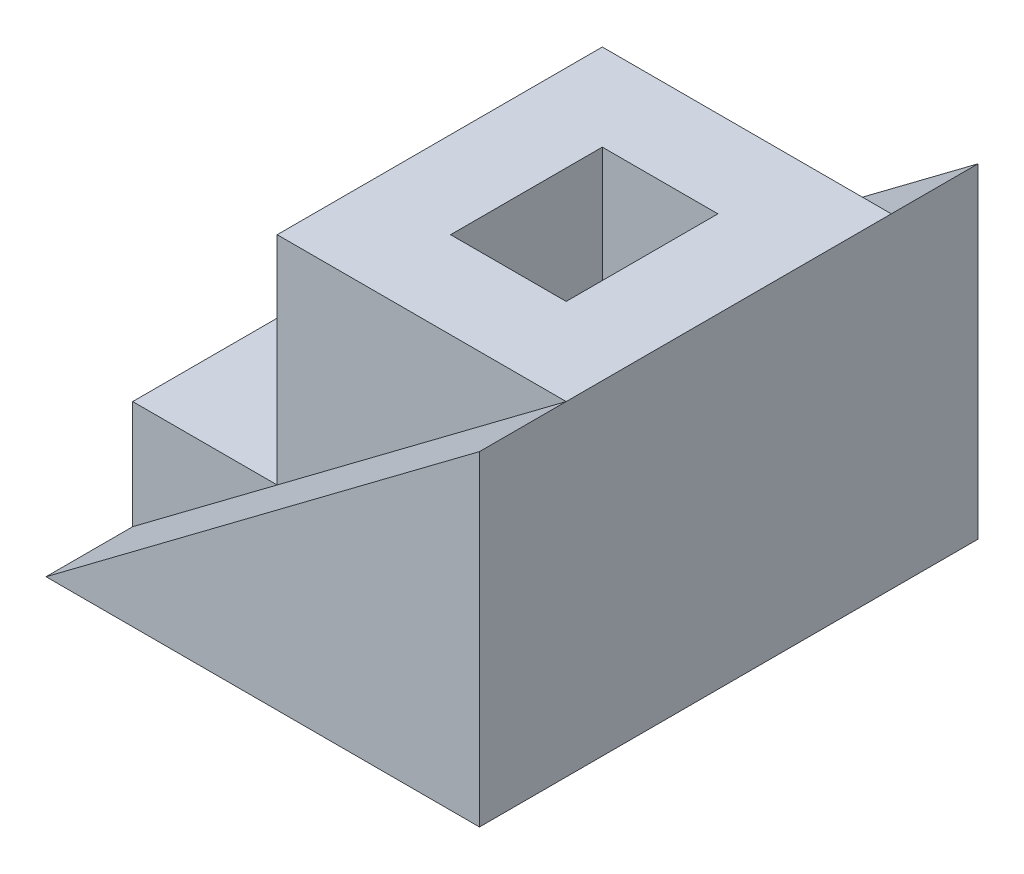
from build123d import *

# Parameters (mm, degrees)
EXTRUDE_1_DEPTH      = 15
EXTRUDE_1_DEPTH_BACK = 15
EXTRUDE_2_DEPTH      = 8
SKETCH_3_W           = 10.666666667
SKETCH_3_H           = 14
CUT_EXTRUDE_1_DEPTH  = 43.766809561


with BuildPart() as part:
    # Эскиз1 → Бобышка-Вытянуть1 (new, two sides: drawn at the far end of the back side and taken through both)
    with BuildSketch(Plane.XY.offset(-EXTRUDE_1_DEPTH_BACK)):
        Polygon((-6.666666667, -5), (-20, -5), (-20, -15), (20, -15), (20, 15), (-6.666666667, 15), align=None)
    extrude(amount=EXTRUDE_1_DEPTH + EXTRUDE_1_DEPTH_BACK)

    # Эскиз2 → Бобышка-Вытянуть2 (add)
    with BuildSketch(Plane.XY.offset(15)):
        Polygon((-20, -15), (20, 15), (20, -15), align=None)
    extrude_2 = extrude(amount=EXTRUDE_2_DEPTH)

    # Зеркальное отражение1: Бобышка-Вытянуть2 across plane
    add(extrude_2.mirror(Plane.XY))

    # Эскиз3 → Вырез-Вытянуть1 (cut, through all)
    with BuildSketch(Plane(origin=(0, 15, 0), x_dir=(1, 0, 0), z_dir=(0, 1, 0))):
        with Locations((6.666666667, 0)):
            Rectangle(SKETCH_3_W, SKETCH_3_H)
    extrude(amount=-CUT_EXTRUDE_1_DEPTH, mode=Mode.SUBTRACT)


solid = part.part
